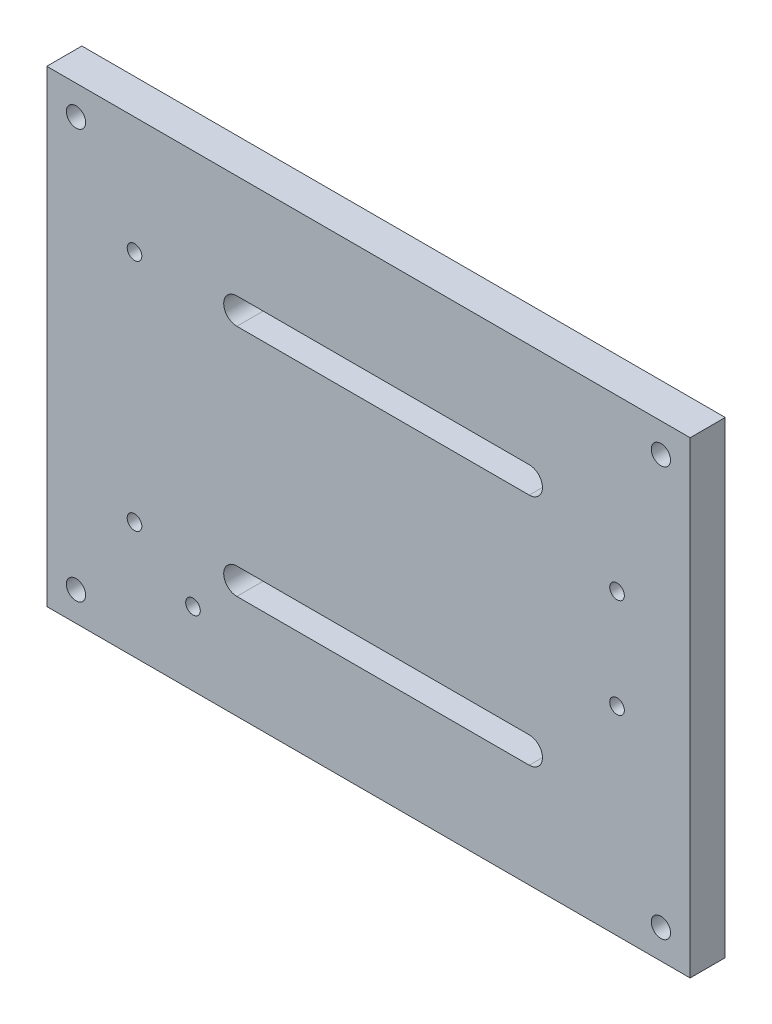
from build123d import *

# Parameters (mm, degrees)
SKETCH_1_W                  = 220
SKETCH_1_H                  = 160
SKETCH_1_R                  = 3.3
SKETCH_1_R_2                = 2.5
BASE_PLATE_220X160X12_DEPTH = 12


with BuildPart() as part:
    # 草图1 → Base_plate_220x160x12 (new body)
    with BuildSketch(Plane.XY):
        with Locations((110, 80)):
            Rectangle(SKETCH_1_W, SKETCH_1_H)
        with Locations((10, 10)):
            Circle(SKETCH_1_R, mode=Mode.SUBTRACT)
        with Locations((10, 150)):
            Circle(SKETCH_1_R, mode=Mode.SUBTRACT)
        with Locations((210, 10)):
            Circle(SKETCH_1_R, mode=Mode.SUBTRACT)
        with Locations((210, 150)):
            Circle(SKETCH_1_R, mode=Mode.SUBTRACT)
        with Locations((30, 40)):
            Circle(SKETCH_1_R_2, mode=Mode.SUBTRACT)
        with Locations((30, 120)):
            Circle(SKETCH_1_R_2, mode=Mode.SUBTRACT)
        with Locations((50, 25)):
            Circle(SKETCH_1_R_2, mode=Mode.SUBTRACT)
        with Locations((195, 68)):
            Circle(SKETCH_1_R_2, mode=Mode.SUBTRACT)
        with Locations((195, 102)):
            Circle(SKETCH_1_R_2, mode=Mode.SUBTRACT)
        with BuildLine():
            Line((65, 44.5), (165, 44.5))
            ThreePointArc((165, 44.5), (169.5, 40), (165, 35.5))
            Line((165, 35.5), (65, 35.5))
            ThreePointArc((65, 35.5), (60.5, 40), (65, 44.5))
        make_face(mode=Mode.SUBTRACT)
        with BuildLine():
            Line((65, 124.5), (165, 124.5))
            ThreePointArc((165, 124.5), (169.5, 120), (165, 115.5))
            Line((165, 115.5), (65, 115.5))
            ThreePointArc((65, 115.5), (60.5, 120), (65, 124.5))
        make_face(mode=Mode.SUBTRACT)
    extrude(amount=BASE_PLATE_220X160X12_DEPTH)


solid = part.part
